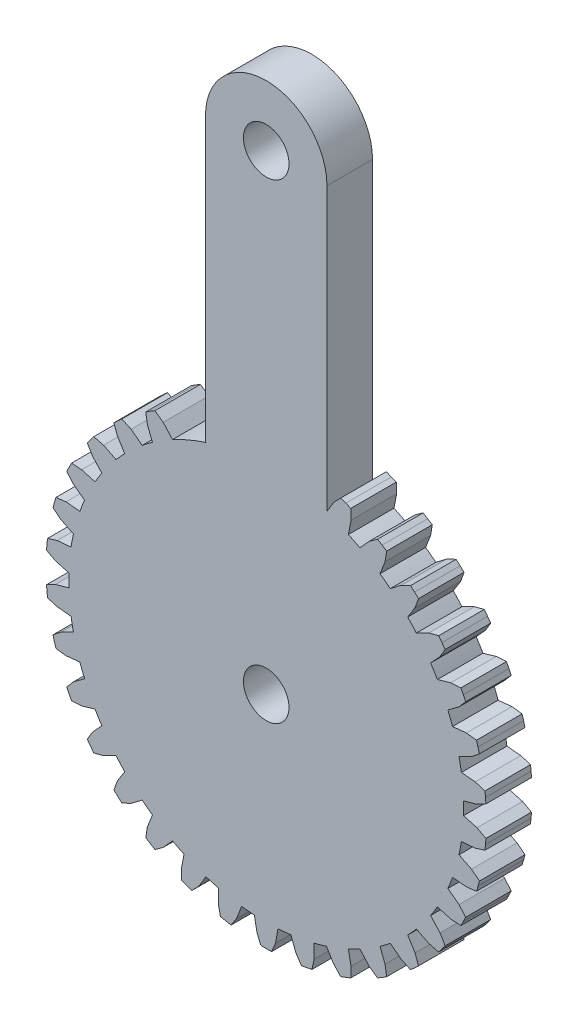
from build123d import *

# Parameters (mm, degrees)
BOSS_EXTRUDE1_DEPTH = 3
SKETCH2_R           = 1.5
CUT_EXTRUDE1_DEPTH  = 7
BOSS_EXTRUDE8_START = -3
SKETCH4_R           = 1.5
BOSS_EXTRUDE8_DEPTH = 3


with BuildPart() as part:
    # Sketch1 → Boss-Extrude1 (new body)
    with BuildSketch(Plane.XY):
        with BuildLine():
            Line((-0.612376666, 13.878994029), (-0.776800125, 12.976770845))
            ThreePointArc((-0.776800125, 12.976770845), (-12.944544292, 1.199488673), (-3.148049012, -12.613080013))
            Line((-3.148049012, -12.613080013), (-3.15220825, -13.530153864))
            Line((-3.15220825, -13.530153864), (-3.012443123, -14.183623882))
            Line((-3.012443123, -14.183623882), (-2.664368008, -14.253109945))
            Line((-2.664368008, -14.253109945), (-2.314696368, -14.314055356))
            Line((-2.314696368, -14.314055356), (-1.948308671, -13.755201698))
            Line((-1.948308671, -13.755201698), (-1.620901759, -12.89855331))
            ThreePointArc((-1.620901759, -12.89855331), (-1.199488673, -12.944544292), (-0.776800125, -12.976770845))
            Line((-0.776800125, -12.976770845), (-0.612376666, -13.878994029))
            Line((-0.612376666, -13.878994029), (-0.354916505, -14.495655703))
            Line((-0.354916505, -14.495655703), (0, -14.5))
            Line((0, -14.5), (0.354916505, -14.495655703))
            Line((0.354916505, -14.495655703), (0.612376666, -13.878994029))
            Line((0.612376666, -13.878994029), (0.776800125, -12.976770845))
            ThreePointArc((0.776800125, -12.976770845), (1.199488673, -12.944544292), (1.620901759, -12.89855331))
            Line((1.620901759, -12.89855331), (1.948308671, -13.755201698))
            Line((1.948308671, -13.755201698), (2.314696368, -14.314055356))
            Line((2.314696368, -14.314055356), (2.664368008, -14.253109945))
            Line((2.664368008, -14.253109945), (3.012443123, -14.183623882))
            Line((3.012443123, -14.183623882), (3.15220825, -13.530153864))
            Line((3.15220825, -13.530153864), (3.148049012, -12.613080013))
            ThreePointArc((3.148049012, -12.613080013), (3.557618871, -12.503733361), (3.963405777, -12.381091012))
            Line((3.963405777, -12.381091012), (4.442646693, -13.162992471))
            Line((4.442646693, -13.162992471), (4.905485034, -13.64500702))
            Line((4.905485034, -13.64500702), (5.23800416, -13.520847326))
            Line((5.23800416, -13.520847326), (5.567384604, -13.388585761))
            Line((5.567384604, -13.388585761), (5.584695163, -12.720560537))
            Line((5.584695163, -12.720560537), (5.412094866, -11.819865869))
            ThreePointArc((5.412094866, -11.819865869), (5.794598625, -11.637122788), (6.170940766, -11.442005509))
            Line((6.170940766, -11.442005509), (6.78569571, -12.122533323))
            Line((6.78569571, -12.122533323), (7.32922329, -12.511294336))
            Line((7.32922329, -12.511294336), (7.633266362, -12.328148468))
            Line((7.633266362, -12.328148468), (7.932735479, -12.137615409))
            Line((7.932735479, -12.137615409), (7.82700198, -11.477783777))
            Line((7.82700198, -11.477783777), (7.491838321, -10.624140369))
            ThreePointArc((7.491838321, -10.624140369), (7.834250273, -10.374223955), (8.168331768, -10.113276232))
            Line((8.168331768, -10.113276232), (8.897665999, -10.669255841))
            Line((8.897665999, -10.669255841), (9.503373637, -10.951524529))
            Line((9.503373637, -10.951524529), (9.768586833, -10.7156293))
            Line((9.768586833, -10.7156293), (10.027946562, -10.473313122))
            Line((10.027946562, -10.473313122), (9.802769632, -9.844144857))
            Line((9.802769632, -9.844144857), (9.316456206, -9.066622511))
            ThreePointArc((9.316456206, -9.066622511), (9.607115924, -8.758043367), (9.887560028, -8.440151462))
            Line((9.887560028, -8.440151462), (10.706636943, -8.852649649))
            Line((10.706636943, -8.852649649), (11.353897993, -9.01881369))
            Line((11.353897993, -9.01881369), (11.571249796, -8.738202227))
            Line((11.571249796, -8.738202227), (11.781667951, -8.452354718))
            Line((11.781667951, -8.452354718), (11.444715722, -7.875275391))
            Line((11.444715722, -7.875275391), (10.82381335, -7.200351698))
            ThreePointArc((10.82381335, -7.200351698), (11.052822764, -6.843618117), (11.27007929, -6.479607457))
            Line((11.27007929, -6.479607457), (12.151006207, -6.73457709))
            Line((12.151006207, -6.73457709), (12.81777897, -6.778977966))
            Line((12.81777897, -6.778977966), (12.979867725, -6.463206159))
            Line((12.979867725, -6.463206159), (13.134178769, -6.143561512))
            Line((13.134178769, -6.143561512), (12.696925744, -5.638222867))
            Line((12.696925744, -5.638222867), (11.962578511, -5.088881543))
            ThreePointArc((11.962578511, -5.088881543), (12.122138982, -4.69614166), (12.268809519, -4.298408191))
            Line((12.268809519, -4.298408191), (13.181587529, -4.387166586))
            Line((13.181587529, -4.387166586), (13.845165858, -4.308292279))
            Line((13.845165858, -4.308292279), (13.946471826, -3.968113356))
            Line((13.946471826, -3.968113356), (14.039420882, -3.625556687))
            Line((14.039420882, -3.625556687), (13.516757188, -3.209167425))
            Line((13.516757188, -3.209167425), (12.693972409, -2.804115631))
            ThreePointArc((12.693972409, -2.804115631), (12.778650296, -2.388743732), (12.849740155, -1.97083179))
            Line((12.849740155, -1.97083179), (13.763285697, -1.890356385))
            Line((13.763285697, -1.890356385), (14.401072228, -1.690892865))
            Line((14.401072228, -1.690892865), (14.438145556, -1.337891212))
            Line((14.438145556, -1.337891212), (14.466567355, -0.984087877))
            Line((14.466567355, -0.984087877), (13.876291677, -0.670827635))
            Line((13.876291677, -0.670827635), (12.993088302, -0.423858924))
            ThreePointArc((12.993088302, -0.423858924), (13, 0), (12.993088302, 0.423858924))
            Line((12.993088302, 0.423858924), (13.876291677, 0.670827635))
            Line((13.876291677, 0.670827635), (14.466567355, 0.984087877))
            Line((14.466567355, 0.984087877), (14.438145556, 1.337891212))
            Line((14.438145556, 1.337891212), (14.401072228, 1.690892865))
            Line((14.401072228, 1.690892865), (13.763285697, 1.890356385))
            Line((13.763285697, 1.890356385), (12.849740155, 1.97083179))
            ThreePointArc((12.849740155, 1.97083179), (12.778650296, 2.388743732), (12.693972409, 2.804115631))
            Line((12.693972409, 2.804115631), (13.516757188, 3.209167425))
            Line((13.516757188, 3.209167425), (14.039420882, 3.625556687))
            Line((14.039420882, 3.625556687), (13.946471826, 3.968113356))
            Line((13.946471826, 3.968113356), (13.845165858, 4.308292279))
            Line((13.845165858, 4.308292279), (13.181587529, 4.387166586))
            Line((13.181587529, 4.387166586), (12.268809519, 4.298408191))
            ThreePointArc((12.268809519, 4.298408191), (12.122138982, 4.69614166), (11.962578511, 5.088881543))
            Line((11.962578511, 5.088881543), (12.696925744, 5.638222867))
            Line((12.696925744, 5.638222867), (13.134178769, 6.143561512))
            Line((13.134178769, 6.143561512), (12.979867725, 6.463206159))
            Line((12.979867725, 6.463206159), (12.81777897, 6.778977966))
            Line((12.81777897, 6.778977966), (12.151006207, 6.73457709))
            Line((12.151006207, 6.73457709), (11.27007929, 6.479607457))
            ThreePointArc((11.27007929, 6.479607457), (11.052822764, 6.843618117), (10.82381335, 7.200351698))
            Line((10.82381335, 7.200351698), (11.444715722, 7.875275391))
            Line((11.444715722, 7.875275391), (11.781667951, 8.452354718))
            Line((11.781667951, 8.452354718), (11.571249796, 8.738202228))
            Line((11.571249796, 8.738202228), (11.353897993, 9.01881369))
            Line((11.353897993, 9.01881369), (10.706636943, 8.852649649))
            Line((10.706636943, 8.852649649), (9.887560028, 8.440151462))
            ThreePointArc((9.887560028, 8.440151462), (9.607115924, 8.758043367), (9.316456206, 9.066622511))
            Line((9.316456206, 9.066622511), (9.802769632, 9.844144857))
            Line((9.802769632, 9.844144857), (10.027946562, 10.473313122))
            Line((10.027946562, 10.473313122), (9.768586833, 10.7156293))
            Line((9.768586833, 10.7156293), (9.503373637, 10.951524529))
            Line((9.503373637, 10.951524529), (8.897665999, 10.669255841))
            Line((8.897665999, 10.669255841), (8.168331768, 10.113276232))
            ThreePointArc((8.168331768, 10.113276232), (7.834250273, 10.374223955), (7.491838321, 10.624140369))
            Line((7.491838321, 10.624140369), (7.82700198, 11.477783777))
            Line((7.82700198, 11.477783777), (7.932735479, 12.137615409))
            Line((7.932735479, 12.137615409), (7.633266362, 12.328148468))
            Line((7.633266362, 12.328148468), (7.32922329, 12.511294336))
            Line((7.32922329, 12.511294336), (6.78569571, 12.122533323))
            Line((6.78569571, 12.122533323), (6.170940766, 11.442005509))
            ThreePointArc((6.170940766, 11.442005509), (5.794598625, 11.637122788), (5.412094866, 11.819865869))
            Line((5.412094866, 11.819865869), (5.584695163, 12.720560537))
            Line((5.584695163, 12.720560537), (5.567384604, 13.388585761))
            Line((5.567384604, 13.388585761), (5.23800416, 13.520847326))
            Line((5.23800416, 13.520847326), (4.905485034, 13.64500702))
            Line((4.905485034, 13.64500702), (4.442646693, 13.162992471))
            Line((4.442646693, 13.162992471), (3.963405777, 12.381091012))
            ThreePointArc((3.963405777, 12.381091012), (3.557618871, 12.503733361), (3.148049012, 12.613080013))
            Line((3.148049012, 12.613080013), (3.15220825, 13.530153864))
            Line((3.15220825, 13.530153864), (3.012443123, 14.183623882))
            Line((3.012443123, 14.183623882), (2.664368008, 14.253109945))
            Line((2.664368008, 14.253109945), (2.314696368, 14.314055356))
            Line((2.314696368, 14.314055356), (1.948308671, 13.755201698))
            Line((1.948308671, 13.755201698), (1.620901759, 12.89855331))
            ThreePointArc((1.620901759, 12.89855331), (1.199488673, 12.944544292), (0.776800125, 12.976770845))
            Line((0.776800125, 12.976770845), (0.612376666, 13.878994029))
            Line((0.612376666, 13.878994029), (0.354916505, 14.495655703))
            Line((0.354916505, 14.495655703), (0, 14.5))
            Line((0, 14.5), (-0.354916505, 14.495655703))
            Line((-0.354916505, 14.495655703), (-0.612376666, 13.878994029))
        make_face()
    extrude(amount=BOSS_EXTRUDE1_DEPTH)

    # Sketch2 → Cut-Extrude1 (cut)
    with BuildSketch(Plane.XY.offset(3)):
        Circle(SKETCH2_R)
    extrude(amount=-CUT_EXTRUDE1_DEPTH, mode=Mode.SUBTRACT)

    # Sketch4 → Boss-Extrude8 (add)
    # profile 1 of 14: a face of its own
    with BuildSketch(Plane.XY.offset(3).offset(BOSS_EXTRUDE8_START)):
        with BuildLine():
            Line((-4, 31), (-4, 12.440796006))
            Line((-4, 12.440796006), (-3.963405777, 12.381091012))
            ThreePointArc((-3.963405777, 12.381091012), (-2.388743732, 12.778650296), (-0.776800125, 12.976770845))
            Line((-0.776800125, 12.976770845), (-0.612376666, 13.878994029))
            Line((-0.612376666, 13.878994029), (-0.354916505, 14.495655703))
            Line((-0.354916505, 14.495655703), (0, 14.5))
            Line((0, 14.5), (0.354916505, 14.495655703))
            Line((0.354916505, 14.495655703), (0.612376666, 13.878994029))
            Line((0.612376666, 13.878994029), (0.776800125, 12.976770845))
            ThreePointArc((0.776800125, 12.976770845), (1.199488673, 12.944544292), (1.620901759, 12.89855331))
            Line((1.620901759, 12.89855331), (1.948308671, 13.755201698))
            Line((1.948308671, 13.755201698), (2.314696368, 14.314055356))
            Line((2.314696368, 14.314055356), (2.664368008, 14.253109945))
            Line((2.664368008, 14.253109945), (3.012443123, 14.183623882))
            Line((3.012443123, 14.183623882), (3.15220825, 13.530153864))
            Line((3.15220825, 13.530153864), (3.148049012, 12.613080013))
            ThreePointArc((3.148049012, 12.613080013), (3.557618871, 12.503733361), (3.963405777, 12.381091012))
            Line((3.963405777, 12.381091012), (4, 12.440796006))
            Line((4, 12.440796006), (4, 31))
            ThreePointArc((4, 31), (0, 35), (-4, 31))
        make_face()
        with Locations((0, 31)):
            Circle(SKETCH4_R, mode=Mode.SUBTRACT)
    # profile 2 of 14: a face of its own
    with BuildSketch(Plane.XY.offset(3).offset(BOSS_EXTRUDE8_START)):
        with BuildLine():
            ThreePointArc((-7.491838321, 10.624140369), (-6.843618117, 11.052822764), (-6.170940766, 11.442005509))
            Line((-6.170940766, 11.442005509), (-6.78569571, 12.122533323))
            Line((-6.78569571, 12.122533323), (-7.32922329, 12.511294336))
            Line((-7.32922329, 12.511294336), (-7.633266362, 12.328148468))
            Line((-7.633266362, 12.328148468), (-7.932735479, 12.137615409))
            Line((-7.932735479, 12.137615409), (-7.82700198, 11.477783777))
            Line((-7.82700198, 11.477783777), (-7.491838321, 10.624140369))
        make_face()
    # profile 3 of 14: a face of its own
    with BuildSketch(Plane.XY.offset(3).offset(BOSS_EXTRUDE8_START)):
        with BuildLine():
            ThreePointArc((-9.316456206, 9.066622511), (-8.758043367, 9.607115924), (-8.168331768, 10.113276232))
            Line((-8.168331768, 10.113276232), (-8.897665999, 10.669255841))
            Line((-8.897665999, 10.669255841), (-9.503373637, 10.951524529))
            Line((-9.503373637, 10.951524529), (-9.768586833, 10.7156293))
            Line((-9.768586833, 10.7156293), (-10.027946562, 10.473313122))
            Line((-10.027946562, 10.473313122), (-9.802769632, 9.844144857))
            Line((-9.802769632, 9.844144857), (-9.316456206, 9.066622511))
        make_face()
    # profile 4 of 14: a face of its own
    with BuildSketch(Plane.XY.offset(3).offset(BOSS_EXTRUDE8_START)):
        with BuildLine():
            ThreePointArc((-10.82381335, 7.200351698), (-10.374223955, 7.834250273), (-9.887560028, 8.440151462))
            Line((-9.887560028, 8.440151462), (-10.706636943, 8.852649649))
            Line((-10.706636943, 8.852649649), (-11.353897993, 9.01881369))
            Line((-11.353897993, 9.01881369), (-11.571249796, 8.738202227))
            Line((-11.571249796, 8.738202227), (-11.781667951, 8.452354718))
            Line((-11.781667951, 8.452354718), (-11.444715722, 7.875275391))
            Line((-11.444715722, 7.875275391), (-10.82381335, 7.200351698))
        make_face()
    # profile 5 of 14: a face of its own
    with BuildSketch(Plane.XY.offset(3).offset(BOSS_EXTRUDE8_START)):
        with BuildLine():
            ThreePointArc((-11.962578511, 5.088881543), (-11.637122788, 5.794598625), (-11.27007929, 6.479607457))
            Line((-11.27007929, 6.479607457), (-12.151006207, 6.73457709))
            Line((-12.151006207, 6.73457709), (-12.81777897, 6.778977966))
            Line((-12.81777897, 6.778977966), (-12.979867725, 6.463206159))
            Line((-12.979867725, 6.463206159), (-13.134178769, 6.143561512))
            Line((-13.134178769, 6.143561512), (-12.696925744, 5.638222867))
            Line((-12.696925744, 5.638222867), (-11.962578511, 5.088881543))
        make_face()
    # profile 6 of 14: a face of its own
    with BuildSketch(Plane.XY.offset(3).offset(BOSS_EXTRUDE8_START)):
        with BuildLine():
            ThreePointArc((-12.693972409, 2.804115631), (-12.503733361, 3.557618871), (-12.268809519, 4.298408191))
            Line((-12.268809519, 4.298408191), (-13.181587529, 4.387166586))
            Line((-13.181587529, 4.387166586), (-13.845165858, 4.308292279))
            Line((-13.845165858, 4.308292279), (-13.946471826, 3.968113356))
            Line((-13.946471826, 3.968113356), (-14.039420882, 3.625556687))
            Line((-14.039420882, 3.625556687), (-13.516757188, 3.209167425))
            Line((-13.516757188, 3.209167425), (-12.693972409, 2.804115631))
        make_face()
    # profile 7 of 14: a face of its own
    with BuildSketch(Plane.XY.offset(3).offset(BOSS_EXTRUDE8_START)):
        with BuildLine():
            ThreePointArc((-12.993088302, 0.423858924), (-12.944544292, 1.199488673), (-12.849740155, 1.97083179))
            Line((-12.849740155, 1.97083179), (-13.763285697, 1.890356385))
            Line((-13.763285697, 1.890356385), (-14.401072228, 1.690892865))
            Line((-14.401072228, 1.690892865), (-14.438145556, 1.337891212))
            Line((-14.438145556, 1.337891212), (-14.466567355, 0.984087877))
            Line((-14.466567355, 0.984087877), (-13.876291677, 0.670827635))
            Line((-13.876291677, 0.670827635), (-12.993088302, 0.423858924))
        make_face()
    # profile 8 of 14: a face of its own
    with BuildSketch(Plane.XY.offset(3).offset(BOSS_EXTRUDE8_START)):
        with BuildLine():
            ThreePointArc((-12.849740155, -1.97083179), (-12.944544292, -1.199488673), (-12.993088302, -0.423858924))
            Line((-12.993088302, -0.423858924), (-13.876291677, -0.670827635))
            Line((-13.876291677, -0.670827635), (-14.466567355, -0.984087877))
            Line((-14.466567355, -0.984087877), (-14.438145556, -1.337891212))
            Line((-14.438145556, -1.337891212), (-14.401072228, -1.690892865))
            Line((-14.401072228, -1.690892865), (-13.763285697, -1.890356385))
            Line((-13.763285697, -1.890356385), (-12.849740155, -1.97083179))
        make_face()
    # profile 9 of 14: a face of its own
    with BuildSketch(Plane.XY.offset(3).offset(BOSS_EXTRUDE8_START)):
        with BuildLine():
            ThreePointArc((-12.268809519, -4.298408191), (-12.503733361, -3.557618871), (-12.693972409, -2.804115631))
            Line((-12.693972409, -2.804115631), (-13.516757188, -3.209167425))
            Line((-13.516757188, -3.209167425), (-14.039420882, -3.625556687))
            Line((-14.039420882, -3.625556687), (-13.946471826, -3.968113356))
            Line((-13.946471826, -3.968113356), (-13.845165858, -4.308292279))
            Line((-13.845165858, -4.308292279), (-13.181587529, -4.387166586))
            Line((-13.181587529, -4.387166586), (-12.268809519, -4.298408191))
        make_face()
    # profile 10 of 14: a face of its own
    with BuildSketch(Plane.XY.offset(3).offset(BOSS_EXTRUDE8_START)):
        with BuildLine():
            ThreePointArc((-11.27007929, -6.479607457), (-11.637122788, -5.794598625), (-11.962578511, -5.088881543))
            Line((-11.962578511, -5.088881543), (-12.696925744, -5.638222867))
            Line((-12.696925744, -5.638222867), (-13.134178769, -6.143561512))
            Line((-13.134178769, -6.143561512), (-12.979867725, -6.463206159))
            Line((-12.979867725, -6.463206159), (-12.81777897, -6.778977966))
            Line((-12.81777897, -6.778977966), (-12.151006207, -6.73457709))
            Line((-12.151006207, -6.73457709), (-11.27007929, -6.479607457))
        make_face()
    # profile 11 of 14: a face of its own
    with BuildSketch(Plane.XY.offset(3).offset(BOSS_EXTRUDE8_START)):
        with BuildLine():
            ThreePointArc((-9.887560028, -8.440151462), (-10.374223955, -7.834250273), (-10.82381335, -7.200351698))
            Line((-10.82381335, -7.200351698), (-11.444715722, -7.875275391))
            Line((-11.444715722, -7.875275391), (-11.781667951, -8.452354718))
            Line((-11.781667951, -8.452354718), (-11.571249796, -8.738202228))
            Line((-11.571249796, -8.738202228), (-11.353897993, -9.01881369))
            Line((-11.353897993, -9.01881369), (-10.706636943, -8.852649649))
            Line((-10.706636943, -8.852649649), (-9.887560028, -8.440151462))
        make_face()
    # profile 12 of 14: a face of its own
    with BuildSketch(Plane.XY.offset(3).offset(BOSS_EXTRUDE8_START)):
        with BuildLine():
            ThreePointArc((-8.168331768, -10.113276232), (-8.758043367, -9.607115924), (-9.316456206, -9.066622511))
            Line((-9.316456206, -9.066622511), (-9.802769632, -9.844144857))
            Line((-9.802769632, -9.844144857), (-10.027946562, -10.473313122))
            Line((-10.027946562, -10.473313122), (-9.768586833, -10.7156293))
            Line((-9.768586833, -10.7156293), (-9.503373637, -10.951524529))
            Line((-9.503373637, -10.951524529), (-8.897665999, -10.669255841))
            Line((-8.897665999, -10.669255841), (-8.168331768, -10.113276232))
        make_face()
    # profile 13 of 14: a face of its own
    with BuildSketch(Plane.XY.offset(3).offset(BOSS_EXTRUDE8_START)):
        with BuildLine():
            ThreePointArc((-6.170940766, -11.442005509), (-6.843618117, -11.052822764), (-7.491838321, -10.624140369))
            Line((-7.491838321, -10.624140369), (-7.82700198, -11.477783777))
            Line((-7.82700198, -11.477783777), (-7.932735479, -12.137615409))
            Line((-7.932735479, -12.137615409), (-7.633266362, -12.328148468))
            Line((-7.633266362, -12.328148468), (-7.32922329, -12.511294336))
            Line((-7.32922329, -12.511294336), (-6.78569571, -12.122533323))
            Line((-6.78569571, -12.122533323), (-6.170940766, -11.442005509))
        make_face()
    # profile 14 of 14: a face of its own
    with BuildSketch(Plane.XY.offset(3).offset(BOSS_EXTRUDE8_START)):
        with BuildLine():
            ThreePointArc((-3.963405777, -12.381091012), (-4.69614166, -12.122138982), (-5.412094866, -11.819865869))
            Line((-5.412094866, -11.819865869), (-5.584695163, -12.720560537))
            Line((-5.584695163, -12.720560537), (-5.567384604, -13.388585761))
            Line((-5.567384604, -13.388585761), (-5.23800416, -13.520847326))
            Line((-5.23800416, -13.520847326), (-4.905485034, -13.64500702))
            Line((-4.905485034, -13.64500702), (-4.442646693, -13.162992471))
            Line((-4.442646693, -13.162992471), (-3.963405777, -12.381091012))
        make_face()
    extrude(amount=BOSS_EXTRUDE8_DEPTH)


solid = part.part
